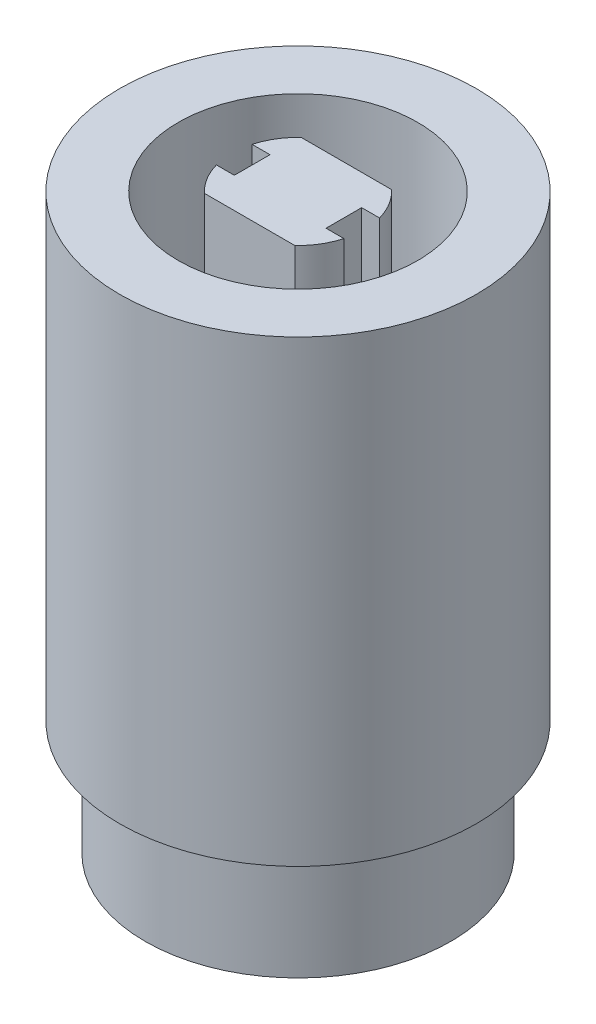
from build123d import *

# Parameters (mm, degrees)
CROQUIS1_R                   = 6
SALIENTE_EXTRUIR1_DEPTH      = 16.5
CROQUIS2_R                   = 4.2
CORTAR_EXTRUIR1_DEPTH        = 14.5
CROQUIS3_R                   = 2.6
SALIENTE_EXTRUIR2_DEPTH      = 6
CORTAR_EXTRUIR4_START        = -6
CORTAR_EXTRUIR4_DEPTH        = 6
CORTAR_EXTRUIR5_START        = -6
CORTAR_EXTRUIR5_DEPTH        = 6
SALIENTE_EXTRUIR3_DEPTH      = 6
SALIENTE_EXTRUIR3_DEPTH_BACK = 12
CROQUIS13_R                  = 7
CROQUIS13_R_2                = 4.7
CORTAR_EXTRUIR9_REACH        = 26.581
CORTAR_EXTRUIR9_END_RADIUS   = 7
CROQUIS14_R                  = 1.4


with BuildPart() as part:
    # Croquis1 → Saliente-Extruir1 (new body)
    with BuildSketch(Plane(origin=(0, 0, 0), x_dir=(1, 0, 0), z_dir=(0, 1, 0))):
        with Locations(Location((0, 0, 0), (0, 0, 270))):
            Circle(CROQUIS1_R)
    extrude(amount=SALIENTE_EXTRUIR1_DEPTH)

    # Croquis2 → Cortar-Extruir1 (cut)
    with BuildSketch(Plane.XZ):
        with Locations(Location((0, 0, 0), (0, 0, 270))):
            Circle(CROQUIS2_R)
    extrude(amount=-CORTAR_EXTRUIR1_DEPTH, mode=Mode.SUBTRACT)

    # Croquis3 → Saliente-Extruir2 (add)
    with BuildSketch(Plane(origin=(0, 16.5, 0), x_dir=(1, 0, 0), z_dir=(0, 1, 0))):
        with Locations(Location((0, 0, 0), (0, 0, 270))):
            Circle(CROQUIS3_R)
    extrude(amount=SALIENTE_EXTRUIR2_DEPTH)

    # Croquis7 → Cortar-Extruir4 (cut)
    with BuildSketch(Plane(origin=(0, 22.5, 0), x_dir=(1, 0, 0), z_dir=(0, 1, 0)).offset(CORTAR_EXTRUIR4_START)):
        with BuildLine():
            Line((-1.774823935, -1.9), (1.774823935, -1.9))
            ThreePointArc((1.774823935, -1.9), (0, -2.6), (-1.774823935, -1.9))
        make_face()
        with BuildLine():
            Line((-1.774823935, 1.9), (1.774823935, 1.9))
            ThreePointArc((1.774823935, 1.9), (0, 2.6), (-1.774823935, 1.9))
        make_face()
    extrude(amount=CORTAR_EXTRUIR4_DEPTH, mode=Mode.SUBTRACT)

    # Croquis10 → Cortar-Extruir5 (cut)
    with BuildSketch(Plane(origin=(0, 22.5, 0), x_dir=(1, 0, 0), z_dir=(0, 1, 0)).offset(CORTAR_EXTRUIR5_START)):
        with BuildLine():
            Line((-1.8, 0.7), (-2.503996805, 0.7))
            ThreePointArc((-2.503996805, 0.7), (-2.6, 0), (-2.503996805, -0.7))
            Line((-2.503996805, -0.7), (-1.8, -0.7))
            Line((-1.8, -0.7), (-1.8, 0.7))
        make_face()
        with BuildLine():
            Line((2.503996805, 0.7), (1.8, 0.7))
            Line((1.8, 0.7), (1.8, -0.7))
            Line((1.8, -0.7), (2.503996805, -0.7))
            ThreePointArc((2.503996805, -0.7), (2.6, 0), (2.503996805, 0.7))
        make_face()
    extrude(amount=CORTAR_EXTRUIR5_DEPTH, mode=Mode.SUBTRACT)

    # Croquis13 → Saliente-Extruir3 (add, two sides: drawn at the far end of the back side and taken through both)
    with BuildSketch(Plane(origin=(0, 16.5, 0), x_dir=(1, 0, 0), z_dir=(0, 1, 0)).offset(-SALIENTE_EXTRUIR3_DEPTH_BACK)):
        with Locations(Location((0, 0, 0), (0, 0, 270))):
            Circle(CROQUIS13_R)
        with Locations(Location((0, 0, 0), (0, 0, 270))):
            Circle(CROQUIS13_R_2, mode=Mode.SUBTRACT)
    extrude(amount=SALIENTE_EXTRUIR3_DEPTH + SALIENTE_EXTRUIR3_DEPTH_BACK)

    # Cortar-Extruir9: up to this cylinder (the profile starts inside it)
    cortar_extruir9_end = Plane(origin=(0, 10, 0), z_dir=(0, 1, 0)) * Cylinder(CORTAR_EXTRUIR9_END_RADIUS, 68.162, mode=Mode.PRIVATE)
    # Croquis14 → Cortar-Extruir9 (cut, up to the surface)
    with BuildSketch(Plane.XY, mode=Mode.PRIVATE) as cortar_extruir9_sk1:
        with Locations((0, 10)):
            Circle(CROQUIS14_R)
    cortar_extruir9_tool1 = extrude(cortar_extruir9_sk1.sketch, amount=-CORTAR_EXTRUIR9_REACH, mode=Mode.PRIVATE) & cortar_extruir9_end
    add(cortar_extruir9_tool1.solids().sort_by_distance((0, 10, 0))[0], mode=Mode.SUBTRACT)


solid = part.part
